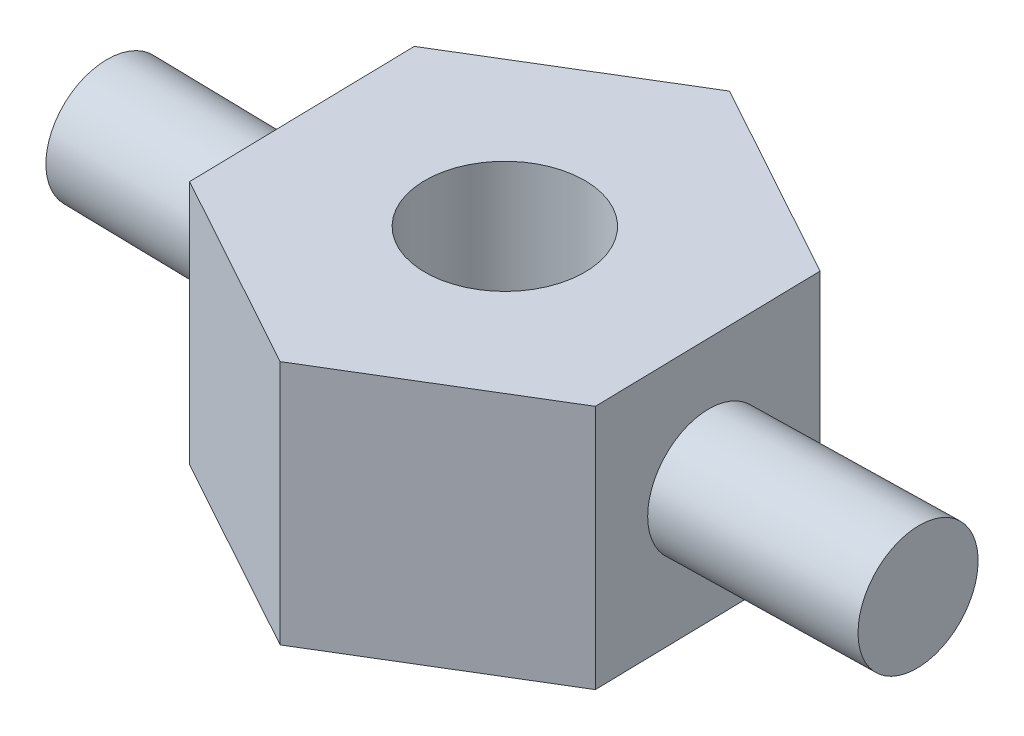
from build123d import *

# Parameters (mm, degrees)
BOSS_EXTRUDE1_DEPTH = 100
SKETCH6_R           = 32.5
CUT_EXTRUDE1_DEPTH  = 160.58632929
SKETCH7_R           = 25
BOSS_EXTRUDE2_DEPTH = 84


with BuildPart() as part:
    # Sketch5 → Boss-Extrude1 (new body)
    with BuildSketch(Plane(origin=(0, 0, 0), x_dir=(1, 0, 0), z_dir=(0, 1, 0))):
        Polygon((-80.025635128, -48.453021269), (1.948729745, -93.530743609), (81.974364872, -45.07772234), (80.025635128, 48.453021269), (-1.948729745, 93.530743609), (-81.974364872, 45.07772234), align=None)
    extrude(amount=BOSS_EXTRUDE1_DEPTH)

    # Sketch6 → Cut-Extrude1 (cut, through all)
    with BuildSketch(Plane(origin=(0, 0, 0), x_dir=(-1, 0, 0), z_dir=(0, -1, 0))):
        with Locations(Location((0, 0, 0), (0, 0, 90))):
            Circle(SKETCH6_R)
    extrude(amount=-CUT_EXTRUDE1_DEPTH, mode=Mode.SUBTRACT)

    # Sketch7 → Boss-Extrude2 (add)
    with BuildSketch(Plane(origin=(81, 0, -1.687649464), x_dir=(-0.020830657718770396, 0, -0.9997830183089746), z_dir=(0.9997830183089746, 0, -0.020830657718770396))):
        with Locations((0, 50)):
            Circle(SKETCH7_R)
    boss_extrude2 = extrude(amount=BOSS_EXTRUDE2_DEPTH)

    # Mirror1: Boss-Extrude2 across plane
    add(boss_extrude2.mirror(Plane(origin=(0, 0, 0), x_dir=(0, 0, 1), z_dir=(1, 0, 0))))


solid = part.part
